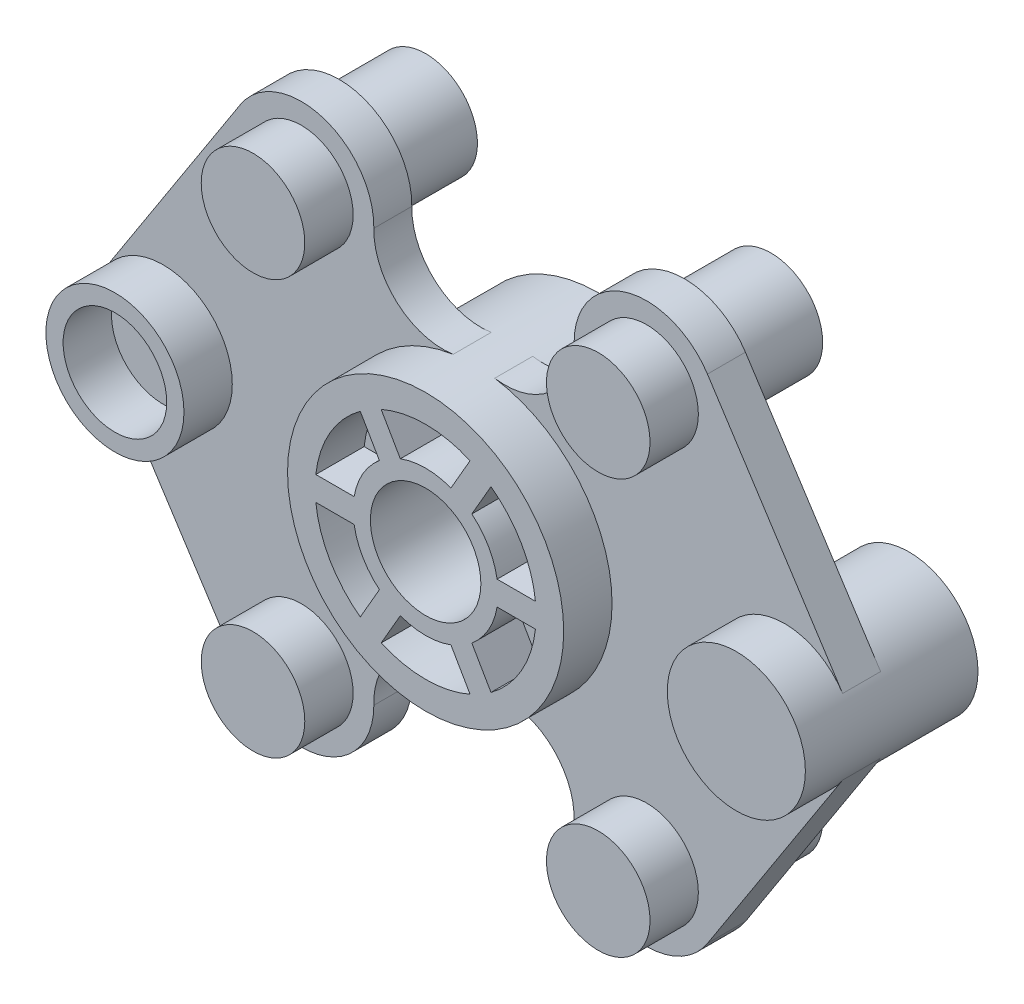
from build123d import *
from build123d.topology import SkipClean

# Parameters (mm, degrees)
BOSS_EXTRUDE1_DEPTH   = 11
BOSS_EXTRUDE1_2_DEPTH = 11
BOSS_EXTRUDE1_3_DEPTH = 11
BOSS_EXTRUDE1_4_DEPTH = 11
BOSS_EXTRUDE1_5_DEPTH = 11
BOSS_EXTRUDE1_6_DEPTH = 11
SKETCH1_R             = 15
BOSS_EXTRUDE1_7_DEPTH = 11
BOSS_EXTRUDE1_8_DEPTH = 11
SKETCH1_3_R           = 20
SKETCH1_3_R_2         = 40
SKETCH1_3_R_3         = 16
SKETCH1_3_R_4         = 15
BOSS_EXTRUDE2_DEPTH   = 25


with BuildPart() as part:
    # Sketch1 → Boss-Extrude1 (new body)
    with BuildSketch(Plane.XY):
        with BuildLine():
            ThreePointArc((13.379398651, 16.186157411), (18.186533479, 10.5), (20.707322833, 3.493820414))
            Line((20.707322833, 3.493820414), (31.808697221, 3.493820414))
            ThreePointArc((31.808697221, 3.493820414), (27.712812921, 16), (18.930085845, 25.800229648))
            Line((18.930085845, 25.800229648), (13.379398651, 16.186157411))
        make_face()
    extrude(amount=BOSS_EXTRUDE1_DEPTH)



with BuildPart() as body_2:
    # Sketch1 → Boss-Extrude1 2 (new body)
    with BuildSketch(Plane.XY):
        with BuildLine():
            Line((31.808697221, -3.493820414), (20.707322833, -3.493820414))
            ThreePointArc((20.707322833, -3.493820414), (18.186533479, -10.5), (13.379398651, -16.186157411))
            Line((13.379398651, -16.186157411), (18.930085845, -25.800229648))
            ThreePointArc((18.930085845, -25.800229648), (27.712812921, -16), (31.808697221, -3.493820414))
        make_face()
    extrude(amount=BOSS_EXTRUDE1_2_DEPTH)


with BuildPart() as body_3:
    # Sketch1 → Boss-Extrude1 3 (new body)
    with BuildSketch(Plane.XY):
        with BuildLine():
            Line((12.878611376, -29.294050062), (7.327924182, -19.679977825))
            ThreePointArc((7.327924182, -19.679977825), (0, -21), (-7.327924182, -19.679977825))
            Line((-7.327924182, -19.679977825), (-12.878611376, -29.294050062))
            ThreePointArc((-12.878611376, -29.294050062), (0, -32), (12.878611376, -29.294050062))
        make_face()
    extrude(amount=BOSS_EXTRUDE1_3_DEPTH)


with BuildPart() as body_4:
    # Sketch1 → Boss-Extrude1 4 (new body)
    with BuildSketch(Plane.XY):
        with BuildLine():
            Line((-18.930085845, -25.800229648), (-13.379398651, -16.186157411))
            ThreePointArc((-13.379398651, -16.186157411), (-18.186533479, -10.5), (-20.707322833, -3.493820414))
            Line((-20.707322833, -3.493820414), (-31.808697221, -3.493820414))
            ThreePointArc((-31.808697221, -3.493820414), (-27.712812921, -16), (-18.930085845, -25.800229648))
        make_face()
    extrude(amount=BOSS_EXTRUDE1_4_DEPTH)


with BuildPart() as body_5:
    # Sketch1 → Boss-Extrude1 5 (new body)
    with BuildSketch(Plane.XY):
        with BuildLine():
            Line((-31.808697221, 3.493820414), (-20.707322833, 3.493820414))
            ThreePointArc((-20.707322833, 3.493820414), (-18.186533479, 10.5), (-13.379398651, 16.186157411))
            Line((-13.379398651, 16.186157411), (-18.930085845, 25.800229648))
            ThreePointArc((-18.930085845, 25.800229648), (-27.712812921, 16), (-31.808697221, 3.493820414))
        make_face()
    extrude(amount=BOSS_EXTRUDE1_5_DEPTH)


with BuildPart() as body_6:
    # Sketch1 → Boss-Extrude1 6 (new body)
    with BuildSketch(Plane.XY):
        with BuildLine():
            Line((-12.878611376, 29.294050062), (-7.327924182, 19.679977825))
            ThreePointArc((-7.327924182, 19.679977825), (0, 21), (7.327924182, 19.679977825))
            Line((7.327924182, 19.679977825), (12.878611376, 29.294050062))
            ThreePointArc((12.878611376, 29.294050062), (0, 32), (-12.878611376, 29.294050062))
        make_face()
    extrude(amount=BOSS_EXTRUDE1_6_DEPTH)


with BuildPart() as body_7:
    # Sketch1 → Boss-Extrude1 7 (new body)
    with BuildSketch(Plane.XY):
        with BuildLine():
            Line((106.793251867, 10.862167911), (67.63291446, 71.405276307))
            ThreePointArc((67.63291446, 71.405276307), (43.887296944, 80.090666025), (29.002885891, 59.651863383))
            ThreePointArc((29.002885891, 59.651863383), (22.168588856, 44.262528341), (6.003756239, 39.546869801))
            ThreePointArc((6.003756239, 39.546869801), (39.99999995, 0.002005859), (6.007722482, -39.546267467))
            ThreePointArc((6.007722482, -39.546267467), (22.304723723, -44.376428641), (29, -60))
            ThreePointArc((29, -60), (44.054043545, -80.140645517), (67.63291446, -71.405276307))
            Line((67.63291446, -71.405276307), (106.793251867, -10.862167911))
            ThreePointArc((106.793251867, -10.862167911), (70, 0), (106.793251867, 10.862167911))
        make_face()
        with Locations((50, -60)):
            Circle(SKETCH1_R, mode=Mode.SUBTRACT)
        with Locations((50, 60)):
            Circle(SKETCH1_R, mode=Mode.SUBTRACT)
    extrude(amount=BOSS_EXTRUDE1_7_DEPTH)


with BuildPart() as body_8:
    # Sketch1 → Boss-Extrude1 8 (new body)
    with BuildSketch(Plane.XY):
        with BuildLine():
            ThreePointArc((-6.007722482, -39.546267467), (-39.99999995, 0.002005859), (-6.003756239, 39.546869801))
            ThreePointArc((-6.003756239, 39.546869801), (-22.168588856, 44.262528341), (-29.002885891, 59.651863383))
            ThreePointArc((-29.002885891, 59.651863383), (-43.887296944, 80.090666025), (-67.63291446, 71.405276307))
            Line((-67.63291446, 71.405276307), (-106.793251867, 10.862167911))
            ThreePointArc((-106.793251867, 10.862167911), (-110, 0), (-106.793251867, -10.862167911))
            Line((-106.793251867, -10.862167911), (-67.63291446, -71.405276307))
            ThreePointArc((-67.63291446, -71.405276307), (-44.054043545, -80.140645517), (-29, -60))
            ThreePointArc((-29, -60), (-22.304723723, -44.376428641), (-6.007722482, -39.546267467))
        make_face()
        with Locations((-50, -60)):
            Circle(SKETCH1_R, mode=Mode.SUBTRACT)
    extrude(amount=BOSS_EXTRUDE1_8_DEPTH)


with BuildPart() as part_1:
    with SkipClean():  # the faces are left unmerged after this step: merging them gives an invalid solid
        add(part.part)

        add(body_2.part)  # Boss-Extrude2 merges body 2

        add(body_3.part)  # Boss-Extrude2 merges body 3

        add(body_4.part)  # Boss-Extrude2 merges body 4

        add(body_5.part)  # Boss-Extrude2 merges body 5

        add(body_6.part)  # Boss-Extrude2 merges body 6

        add(body_7.part)  # Boss-Extrude2 merges body 7

        add(body_8.part)  # Boss-Extrude2 merges body 8
        # Sketch1<3> → Boss-Extrude2 (add, symmetric)
        # profile 1 of 7: a face of its own
        with BuildSketch(Plane.XY):
            with Locations((90, 0)):
                Circle(SKETCH1_3_R)
        # profile 2 of 7: a face of its own
        with BuildSketch(Plane.XY):
            Circle(SKETCH1_3_R_2)
            with BuildLine():
                ThreePointArc((-20.707322833, -3.493820414), (-18.186533479, -10.5), (-13.379398651, -16.186157411))
                Line((-13.379398651, -16.186157411), (-18.930085845, -25.800229648))
                ThreePointArc((-18.930085845, -25.800229648), (-27.712812921, -16), (-31.808697221, -3.493820414))
                Line((-31.808697221, -3.493820414), (-20.707322833, -3.493820414))
            make_face(mode=Mode.SUBTRACT)
            with BuildLine():
                ThreePointArc((-7.327924182, -19.679977825), (0, -21), (7.327924182, -19.679977825))
                Line((7.327924182, -19.679977825), (12.878611376, -29.294050062))
                ThreePointArc((12.878611376, -29.294050062), (0, -32), (-12.878611376, -29.294050062))
                Line((-12.878611376, -29.294050062), (-7.327924182, -19.679977825))
            make_face(mode=Mode.SUBTRACT)
            with BuildLine():
                ThreePointArc((13.379398651, -16.186157411), (18.186533479, -10.5), (20.707322833, -3.493820414))
                Line((20.707322833, -3.493820414), (31.808697221, -3.493820414))
                ThreePointArc((31.808697221, -3.493820414), (27.712812921, -16), (18.930085845, -25.800229648))
                Line((18.930085845, -25.800229648), (13.379398651, -16.186157411))
            make_face(mode=Mode.SUBTRACT)
            with BuildLine():
                ThreePointArc((-13.379398651, 16.186157411), (-18.186533479, 10.5), (-20.707322833, 3.493820414))
                Line((-20.707322833, 3.493820414), (-31.808697221, 3.493820414))
                ThreePointArc((-31.808697221, 3.493820414), (-27.712812921, 16), (-18.930085845, 25.800229648))
                Line((-18.930085845, 25.800229648), (-13.379398651, 16.186157411))
            make_face(mode=Mode.SUBTRACT)
            with BuildLine():
                ThreePointArc((7.327924182, 19.679977825), (0, 21), (-7.327924182, 19.679977825))
                Line((-7.327924182, 19.679977825), (-12.878611376, 29.294050062))
                ThreePointArc((-12.878611376, 29.294050062), (0, 32), (12.878611376, 29.294050062))
                Line((12.878611376, 29.294050062), (7.327924182, 19.679977825))
            make_face(mode=Mode.SUBTRACT)
            Circle(SKETCH1_3_R_3, mode=Mode.SUBTRACT)
            with BuildLine():
                Line((31.808697221, 3.493820414), (20.707322833, 3.493820414))
                ThreePointArc((20.707322833, 3.493820414), (18.186533479, 10.5), (13.379398651, 16.186157411))
                Line((13.379398651, 16.186157411), (18.930085845, 25.800229648))
                ThreePointArc((18.930085845, 25.800229648), (27.712812921, 16), (31.808697221, 3.493820414))
            make_face(mode=Mode.SUBTRACT)
        # profile 3 of 7: a face of its own
        with BuildSketch(Plane.XY):
            with Locations((-90, 0)):
                Circle(SKETCH1_3_R)
            with Locations((-90, 0)):
                Circle(SKETCH1_3_R_4, mode=Mode.SUBTRACT)
        # profile 4 of 7: a face of its own
        with BuildSketch(Plane.XY):
            with Locations((50, 60)):
                Circle(SKETCH1_3_R_4)
        # profile 5 of 7: a face of its own
        with BuildSketch(Plane.XY):
            with Locations((50, -60)):
                Circle(SKETCH1_3_R_4)
        # profile 6 of 7: a face of its own
        with BuildSketch(Plane.XY):
            with Locations((-50, -60)):
                Circle(SKETCH1_3_R_4)
        # profile 7 of 7: a face of its own
        with BuildSketch(Plane.XY):
            with Locations((-50, 60)):
                Circle(SKETCH1_3_R_4)
        extrude(amount=BOSS_EXTRUDE2_DEPTH, both=True)


solid = part_1.part
